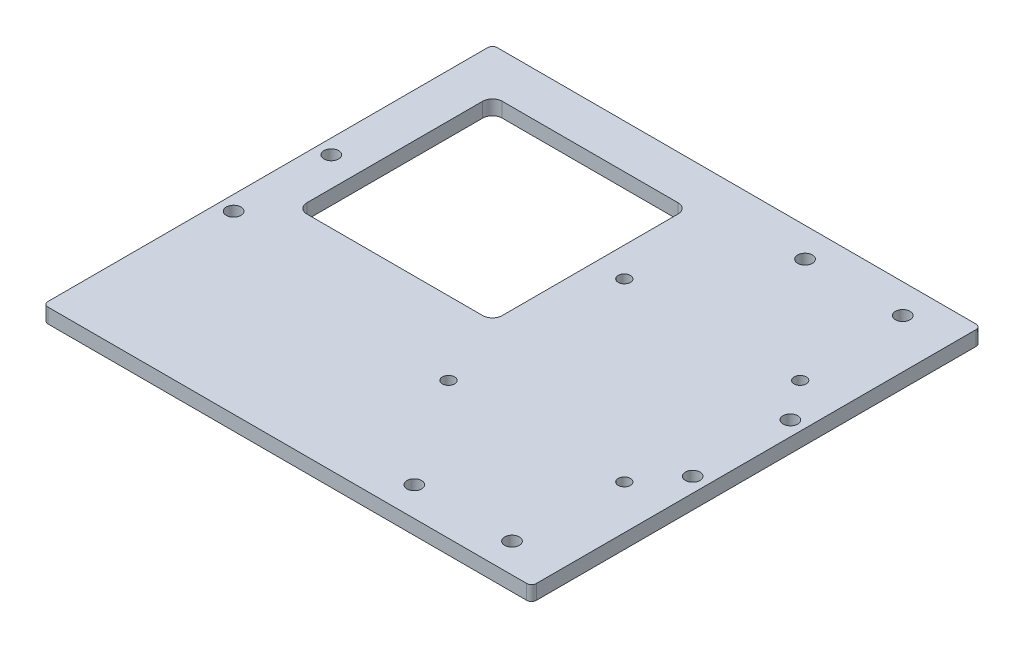
from build123d import *

# Parameters (mm, degrees)
SKETCH_1_W          = 100
SKETCH_1_H          = 92
EXTRUDE_1_DEPTH     = 3
SKETCH_2_R          = 1.5
CUT_EXTRUDE_1_DEPTH = 136.915414873
SKETCH_3_W          = 40
SKETCH_3_H          = 40
CUT_EXTRUDE_2_DEPTH = 10
FILLET_1_R          = 2
FILLET_2_R          = 1
SKETCH_4_R          = 1.25
CUT_EXTRUDE_3_DEPTH = 10


with BuildPart() as part:
    # 草图1 → 凸台-拉伸1 (new body)
    with BuildSketch(Plane(origin=(0, 0, 0), x_dir=(1, 0, 0), z_dir=(0, 1, 0))):
        with Locations((50, 46)):
            Rectangle(SKETCH_1_W, SKETCH_1_H)
    extrude(amount=EXTRUDE_1_DEPTH)

    # 草图2 → 切除-拉伸1 (cut, through all)
    with BuildSketch(Plane(origin=(0, 3, 0), x_dir=(1, 0, 0), z_dir=(0, 1, 0))):
        with Locations(Location((90, 86, 0), (0, 0, 270))):
            Circle(SKETCH_2_R)
        with Locations(Location((70, 86, 0), (0, 0, 270))):
            Circle(SKETCH_2_R)
        with Locations(Location((70, 6, 0), (0, 0, 270))):
            Circle(SKETCH_2_R)
        with Locations(Location((90, 6, 0), (0, 0, 270))):
            Circle(SKETCH_2_R)
        with Locations(Location((97, 56, 0), (0, 0, 270))):
            Circle(SKETCH_2_R)
        with Locations(Location((97, 36, 0), (0, 0, 270))):
            Circle(SKETCH_2_R)
        with Locations(Location((3, 36, 0), (0, 0, 90))):
            Circle(SKETCH_2_R)
        with Locations(Location((3, 56, 0), (0, 0, 90))):
            Circle(SKETCH_2_R)
    extrude(amount=-CUT_EXTRUDE_1_DEPTH, mode=Mode.SUBTRACT)

    # 草图3 → 切除-拉伸2 (cut)
    with BuildSketch(Plane(origin=(0, 3, 0), x_dir=(1, 0, 0), z_dir=(0, 1, 0))):
        with Locations((29, 63)):
            Rectangle(SKETCH_3_W, SKETCH_3_H)
    extrude(amount=-CUT_EXTRUDE_2_DEPTH, mode=Mode.SUBTRACT)

    # 圆角1
    fillet_1_edges = [part.edges().sort_by_distance(p)[0] for p in [
        (49, 1.5, -43),
        (9, 1.5, -43),
        (9, 1.5, -83),
        (49, 1.5, -83),
    ]]
    fillet(fillet_1_edges, radius=FILLET_1_R)

    # 圆角2
    fillet_2_edges = [part.edges().sort_by_distance(p)[0] for p in [
        (0, 1.5, -92),
        (100, 1.5, -92),
        (100, 1.5, 0),
        (0, 1.5, 0),
    ]]
    fillet(fillet_2_edges, radius=FILLET_2_R)

    # 草图4 → 切除-拉伸3 (cut)
    with BuildSketch(Plane.XZ):
        with Locations(Location((55, -28, 0), (0, 0, 270))):
            Circle(SKETCH_4_R)
        with Locations(Location((91, -28, 0), (0, 0, 270))):
            Circle(SKETCH_4_R)
        with Locations(Location((55, -64, 0), (0, 0, 270))):
            Circle(SKETCH_4_R)
        with Locations(Location((91, -64, 0), (0, 0, 270))):
            Circle(SKETCH_4_R)
    extrude(amount=-CUT_EXTRUDE_3_DEPTH, mode=Mode.SUBTRACT)


solid = part.part
